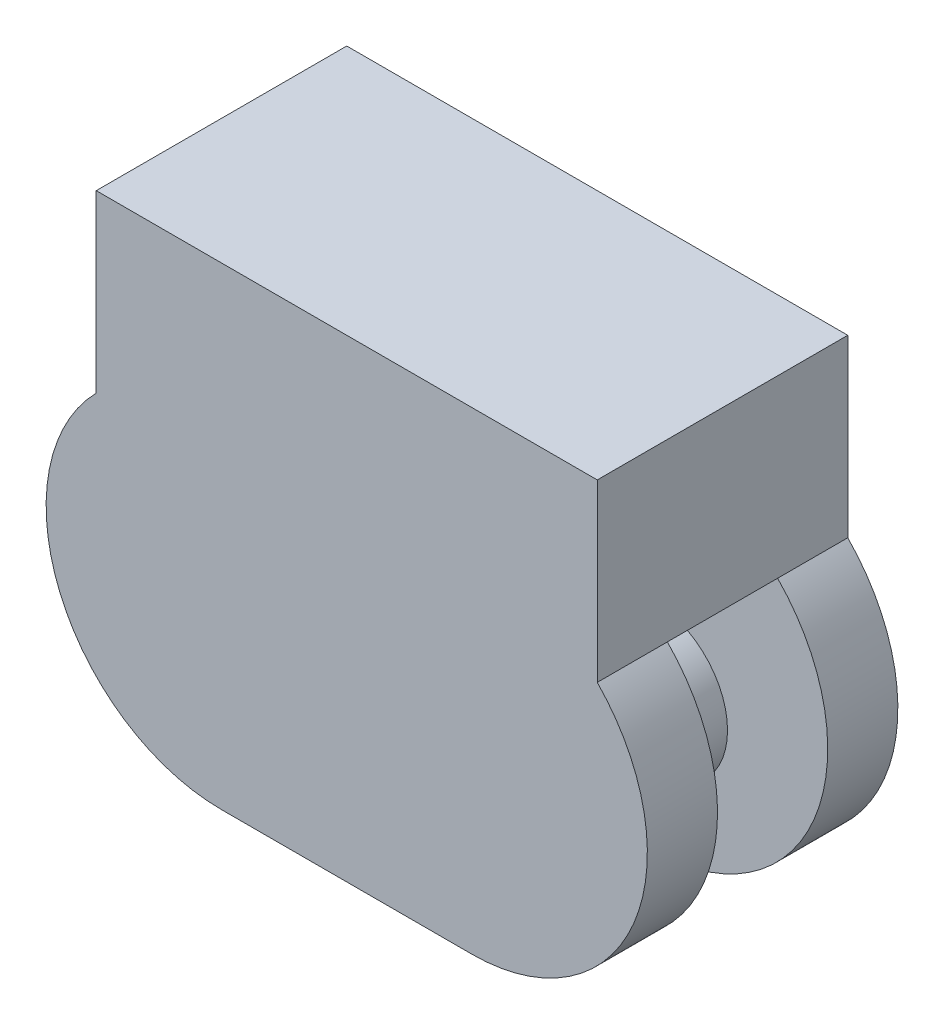
from build123d import *

# Parameters (mm, degrees)
BOSS_EXTRUDE1_DEPTH     = 5
CUT_EXTRUDE1_DEPTH      = 12.517223111
CUT_EXTRUDE1_DEPTH_BACK = 12.517223111
SKETCH2_W               = 2.2
SKETCH2_H               = 5.949489743
BOSS_EXTRUDE2_DEPTH     = 5


with BuildPart() as part:
    # Sketch1 → Boss-Extrude1 (new body)
    with BuildSketch(Plane.XY):
        with BuildLine():
            Line((-7.5, 5.949489743), (2.5, 5.949489743))
            Line((2.5, 5.949489743), (2.5, 2.449489743))
            ThreePointArc((2.5, 2.449489743), (3.226702194, -1.355873501), (0, -3.5))
            Line((0, -3.5), (-5, -3.5))
            ThreePointArc((-5, -3.5), (-8.226702194, -1.355873501), (-7.5, 2.449489743))
            Line((-7.5, 2.449489743), (-7.5, 5.949489743))
        make_face()
    extrude(amount=BOSS_EXTRUDE1_DEPTH)

    # Sketch2 → Cut-Extrude1 (cut, two sides: drawn at the far end of the back side and taken through both)
    with BuildSketch(Plane(origin=(0, 0, 0), x_dir=(0, 0, -1), z_dir=(1, 0, 0)).offset(-CUT_EXTRUDE1_DEPTH_BACK)):
        with Locations((-2.5, -0.525255129)):
            Rectangle(SKETCH2_W, SKETCH2_H)
    extrude(amount=CUT_EXTRUDE1_DEPTH + CUT_EXTRUDE1_DEPTH_BACK, mode=Mode.SUBTRACT)

    # Sketch3 → Boss-Extrude2 (add)
    with BuildSketch(Plane.XY):
        with BuildLine():
            Line((-5, -2.179025152), (0, -2.179025152))
            ThreePointArc((0, -2.179025152), (1.5, -0.679025152), (0, 0.820974848))
            Line((0, 0.820974848), (-5, 0.820974848))
            ThreePointArc((-5, 0.820974848), (-6.5, -0.679025152), (-5, -2.179025152))
        make_face()
    extrude(amount=BOSS_EXTRUDE2_DEPTH)


solid = part.part
